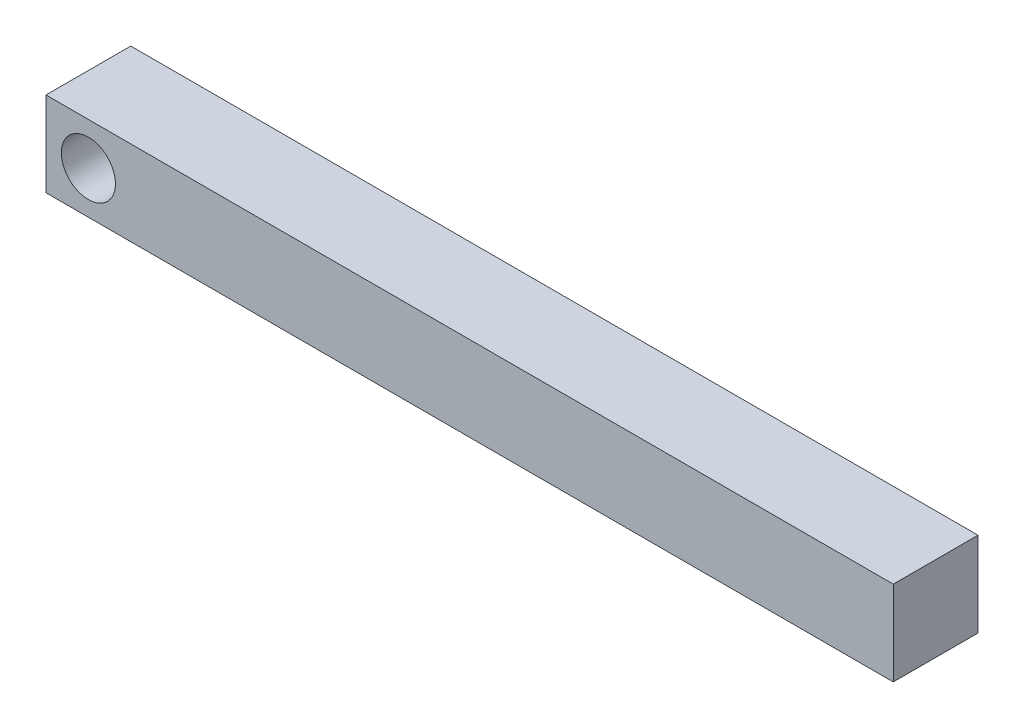
from build123d import *

# Parameters (mm, degrees)
SKETCH1_W          = 200
SKETCH1_H          = 20
EXTRUDE1_DEPTH     = 20
SKETCH2_R          = 6.38668889
CUT_EXTRUDE1_DEPTH = 134.918873157


with BuildPart() as part:
    # Sketch1 → Extrude1 (new body)
    with BuildSketch(Plane(origin=(0, 0, 0), x_dir=(1, 0, 0), z_dir=(0, 1, 0))):
        with Locations((30.897916667, 29.326388889)):
            Rectangle(SKETCH1_W, SKETCH1_H)
    extrude(amount=EXTRUDE1_DEPTH)

    # Sketch2 → Cut-Extrude1 (cut, through all)
    with BuildSketch(Plane.XY.offset(-19.326388889)):
        with Locations((-59.102083333, 10)):
            Circle(SKETCH2_R)
    extrude(amount=-CUT_EXTRUDE1_DEPTH, mode=Mode.SUBTRACT)


solid = part.part
